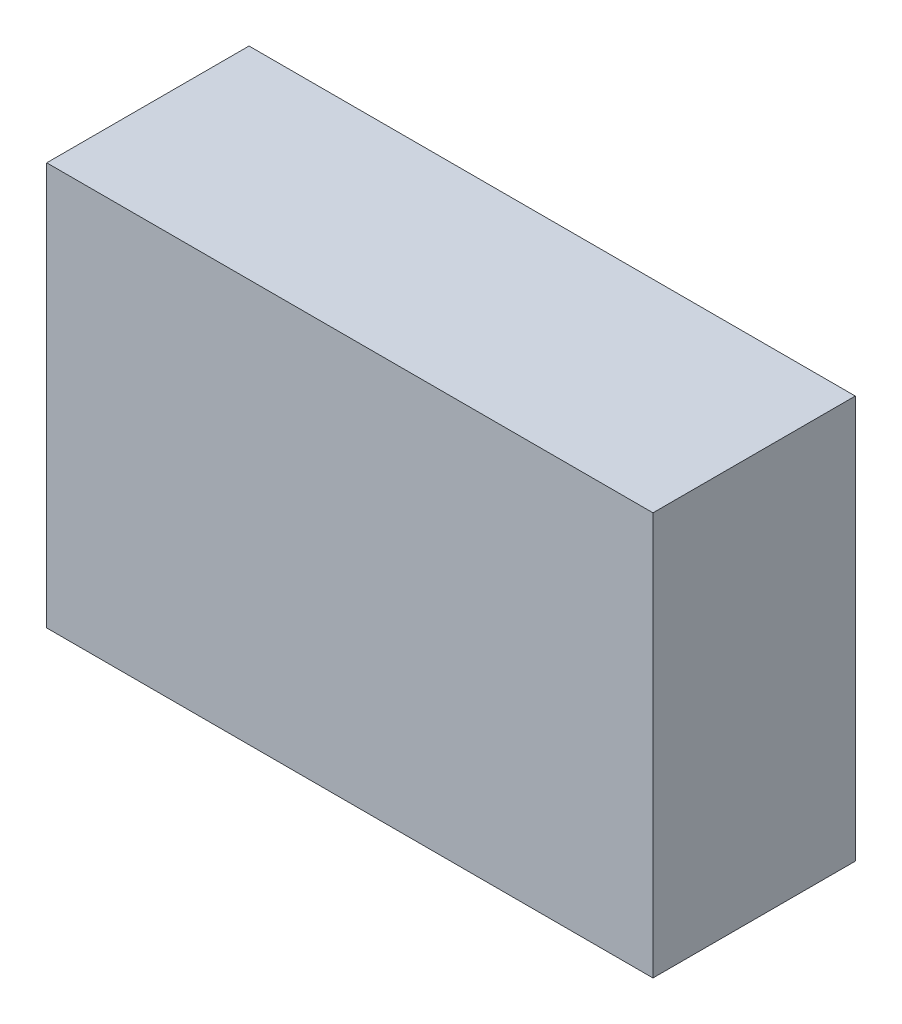
from build123d import *

# Parameters (mm, degrees)
ESQUISSE1_W             = 2.9968
ESQUISSE1_H             = 1.9914
COMPONENT_OUTLINE_DEPTH = 1


with BuildPart() as part:
    # Esquisse1 → Component_Outline (new body)
    with BuildSketch(Plane.XY):
        with Locations((0, 0.0127)):
            Rectangle(ESQUISSE1_W, ESQUISSE1_H)
    extrude(amount=COMPONENT_OUTLINE_DEPTH)


solid = part.part
